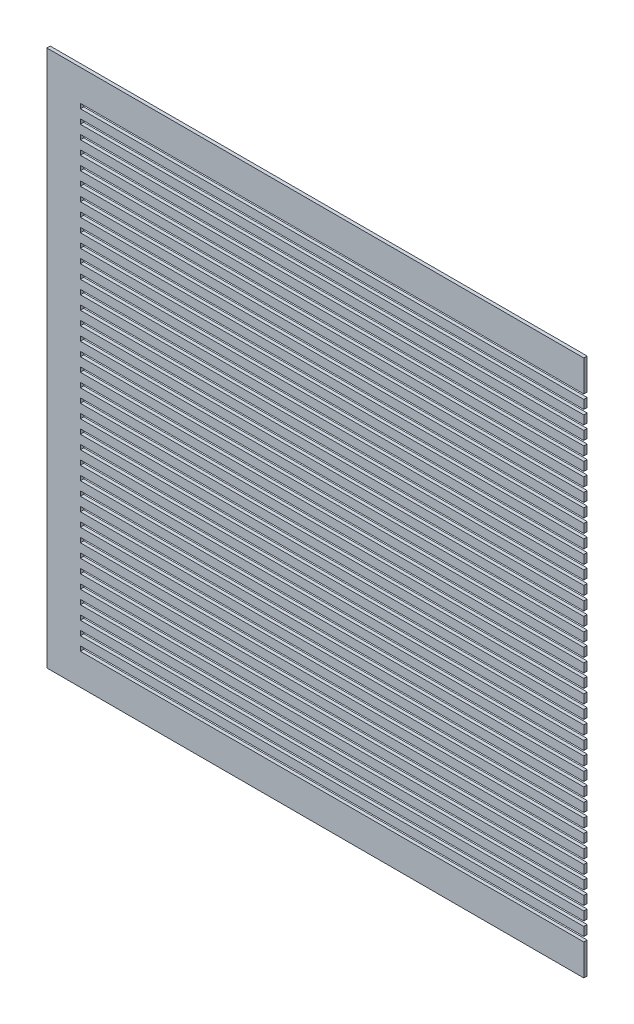
from build123d import *

# Parameters (mm, degrees)
EXTRUDE_1_DEPTH = 1


with BuildPart() as part:
    # 草图1 → 凸台-拉伸1 (new body)
    with BuildSketch(Plane.XY):
        Polygon((-75, -66.463368351), (-75, -65.063368351), (75, -65.063368351), (75, -62.463368351), (-75, -62.463368351), (-75, -61.063368351), (75, -61.063368351), (75, -58.463368351), (-75, -58.463368351), (-75, -57.063368351), (75, -57.063368351), (75, -54.463368351), (-75, -54.463368351), (-75, -53.063368351), (75, -53.063368351), (75, -50.463368351), (-75, -50.463368351), (-75, -49.063368351), (75, -49.063368351), (75, -46.463368351), (-75, -46.463368351), (-75, -45.063368351), (75, -45.063368351), (75, -42.463368351), (-75, -42.463368351), (-75, -41.063368351), (75, -41.063368351), (75, -38.463368351), (-75, -38.463368351), (-75, -37.063368351), (75, -37.063368351), (75, -34.463368351), (-75, -34.463368351), (-75, -33.063368351), (75, -33.063368351), (75, -30.463368351), (-75, -30.463368351), (-75, -29.063368351), (75, -29.063368351), (75, -26.463368351), (-75, -26.463368351), (-75, -25.063368351), (75, -25.063368351), (75, -22.463368351), (-75, -22.463368351), (-75, -21.063368351), (75, -21.063368351), (75, -18.463368351), (-75, -18.463368351), (-75, -17.063368351), (75, -17.063368351), (75, -14.463368351), (-75, -14.463368351), (-75, -13.063368351), (75, -13.063368351), (75, -10.463368351), (-75, -10.463368351), (-75, -9.063368351), (75, -9.063368351), (75, -6.463368351), (-75, -6.463368351), (-75, -5.063368351), (75, -5.063368351), (75, -2.463368351), (-75, -2.463368351), (-75, -1.063368351), (75, -1.063368351), (75, 1.536631649), (-75, 1.536631649), (-75, 2.936631649), (75, 2.936631649), (75, 5.536631649), (-75, 5.536631649), (-75, 6.936631649), (75, 6.936631649), (75, 9.536631649), (-75, 9.536631649), (-75, 10.936631649), (75, 10.936631649), (75, 13.536631649), (-75, 13.536631649), (-75, 14.936631649), (75, 14.936631649), (75, 17.536631649), (-75, 17.536631649), (-75, 18.936631649), (75, 18.936631649), (75, 21.536631649), (-75, 21.536631649), (-75, 22.936631649), (75, 22.936631649), (75, 25.536631649), (-75, 25.536631649), (-75, 26.936631649), (75, 26.936631649), (75, 29.536631649), (-75, 29.536631649), (-75, 30.936631649), (75, 30.936631649), (75, 33.536631649), (-75, 33.536631649), (-75, 34.936631649), (75, 34.936631649), (75, 37.536631649), (-75, 37.536631649), (-75, 38.936631649), (75, 38.936631649), (75, 41.536631649), (-75, 41.536631649), (-75, 42.936631649), (75, 42.936631649), (75, 45.536631649), (-75, 45.536631649), (-75, 46.936631649), (75, 46.936631649), (75, 49.536631649), (-75, 49.536631649), (-75, 50.936631649), (75, 50.936631649), (75, 53.536631649), (-75, 53.536631649), (-75, 54.936631649), (75, 54.936631649), (75, 57.536631649), (-75, 57.536631649), (-75, 58.936631649), (75, 58.936631649), (75, 61.536631649), (-75, 61.536631649), (-75, 62.936631649), (75, 62.936631649), (75, 65.536631649), (-75, 65.536631649), (-75, 66.936631649), (75, 66.936631649), (75, 69.536631649), (-75, 69.536631649), (-75, 70.936631649), (75, 70.936631649), (75, 80.236631649), (-85, 80.236631649), (-85, -79.763368351), (75, -79.763368351), (75, -70.463368351), (-75, -70.463368351), (-75, -69.063368351), (75, -69.063368351), (75, -66.463368351), align=None)
    extrude(amount=EXTRUDE_1_DEPTH)


solid = part.part
